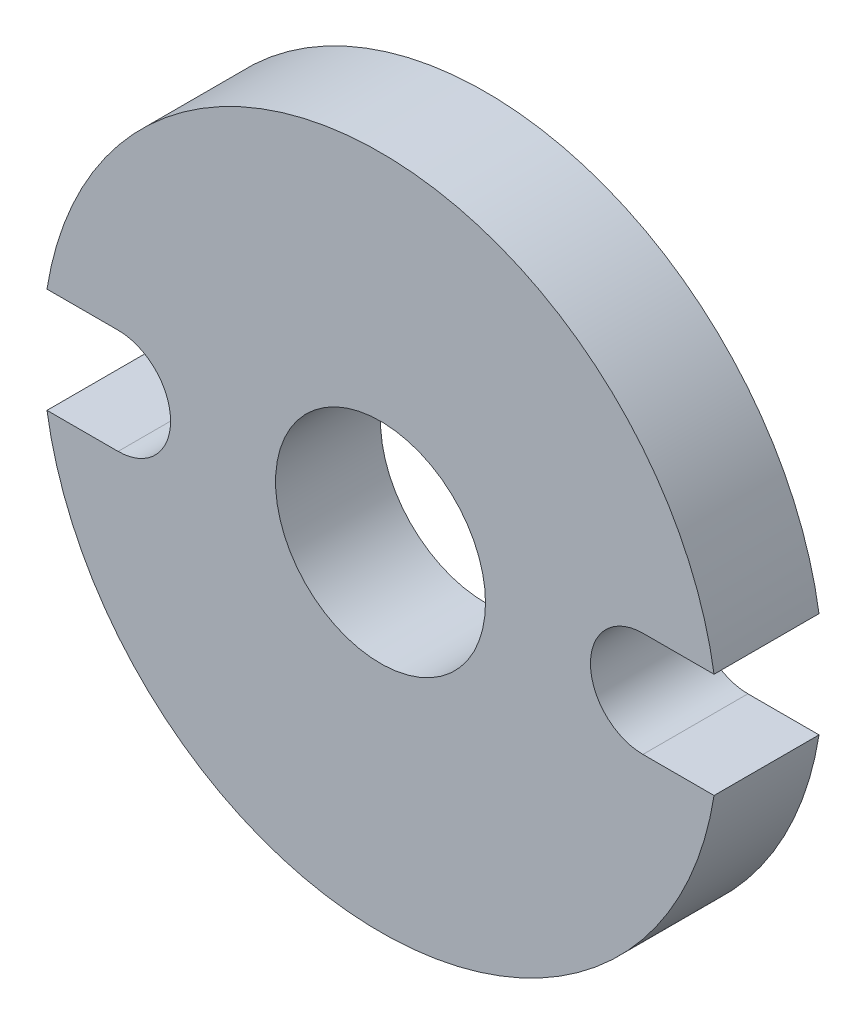
from build123d import *

# Parameters (mm, degrees)
SKETCH_1_R      = 1.5
EXTRUDE_1_DEPTH = 1.5


with BuildPart() as part:
    # Эскиз1 → Бобышка-Вытянуть1 (new body)
    with BuildSketch(Plane.XY):
        with BuildLine():
            ThreePointArc((4.766353428, 0.75), (0, 4.825), (-4.766353428, 0.75))
            Line((-4.766353428, 0.75), (-3.75, 0.75))
            ThreePointArc((-3.75, 0.75), (-3, 0), (-3.75, -0.75))
            Line((-3.75, -0.75), (-4.766353428, -0.75))
            ThreePointArc((-4.766353428, -0.75), (0, -4.825), (4.766353428, -0.75))
            Line((4.766353428, -0.75), (3.75, -0.75))
            ThreePointArc((3.75, -0.75), (3, 0), (3.75, 0.75))
            Line((3.75, 0.75), (4.766353428, 0.75))
        make_face()
        Circle(SKETCH_1_R, mode=Mode.SUBTRACT)
    extrude(amount=EXTRUDE_1_DEPTH)


solid = part.part
